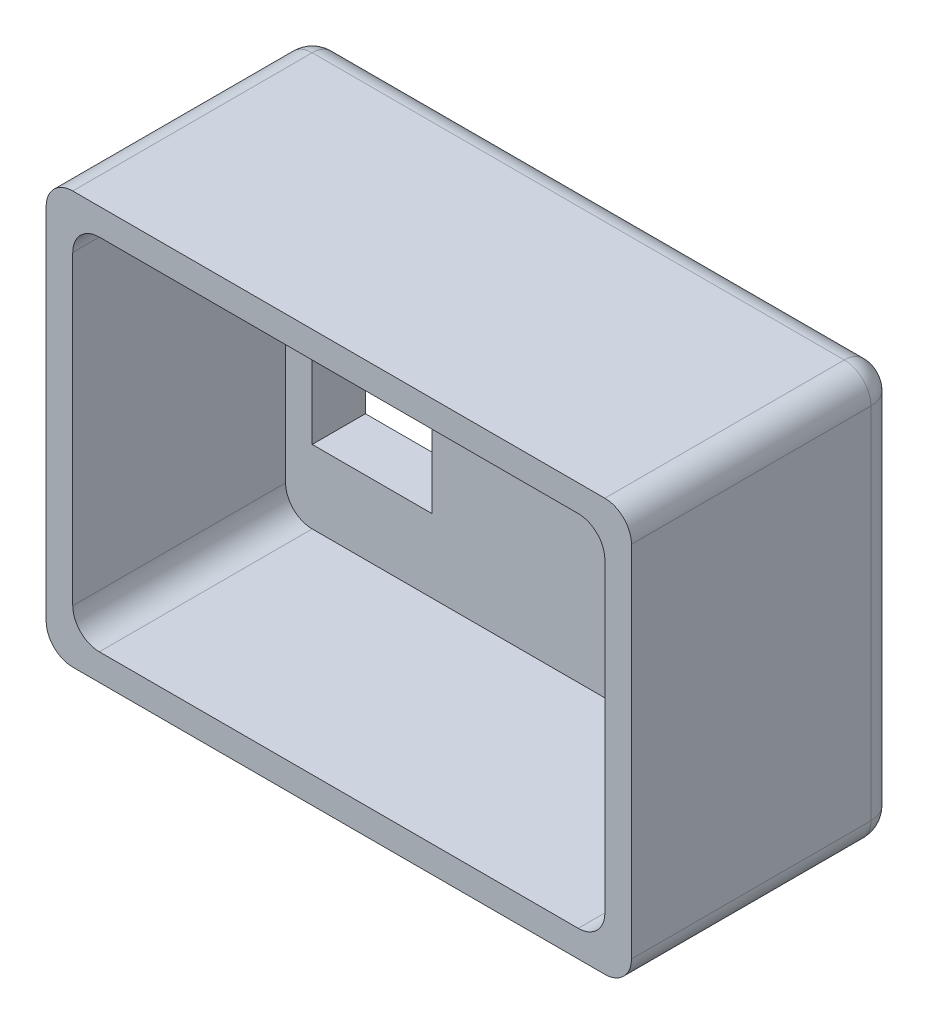
from build123d import *

# Parameters (mm, degrees)
ESQUISSE1_W             = 20
ESQUISSE1_H             = 13.5
BOSS_EXTRU_1_DEPTH      = 2
ESQUISSE1_2_W           = 22
ESQUISSE1_2_H           = 15.5
ESQUISSE1_2_W_2         = 20
ESQUISSE1_2_H_2         = 13.5
EXTRU_MINCE1_DEPTH      = 10
ESQUISSE2_W             = 4.5
ESQUISSE2_H             = 9
ENL_V_MAT_EXTRU_1_DEPTH = 10
CONG_1_R                = 1
CONG_2_R                = 1


with BuildPart() as part:
    # Esquisse1 → Boss.-Extru.1 (new body)
    with BuildSketch(Plane.XY):
        with Locations((10, 6.75)):
            Rectangle(ESQUISSE1_W, ESQUISSE1_H)
    extrude(amount=BOSS_EXTRU_1_DEPTH)

    # Esquisse1<2> → Extru.-Mince1 (add)
    with BuildSketch(Plane.XY):
        with Locations((10, 6.75)):
            Rectangle(ESQUISSE1_2_W, ESQUISSE1_2_H)
        with Locations((10, 6.75)):
            Rectangle(ESQUISSE1_2_W_2, ESQUISSE1_2_H_2, mode=Mode.SUBTRACT)
    extrude(amount=EXTRU_MINCE1_DEPTH)

    # Esquisse2 → Enlèv. mat.-Extru.1 (cut)
    with BuildSketch(Plane.XY.offset(2)):
        with Locations((3.25, 7.25)):
            Rectangle(ESQUISSE2_W, ESQUISSE2_H)
    extrude(amount=-ENL_V_MAT_EXTRU_1_DEPTH, mode=Mode.SUBTRACT)

    # Congé1
    cong_1_edges = [part.edges().sort_by_distance(p)[0] for p in [
        (0, 0, 6),
        (0, 13.5, 6),
        (20, 13.5, 6),
        (20, 0, 6),
        (-1, -1, 5),
        (-1, 14.5, 5),
        (21, -1, 5),
        (21, 14.5, 5),
    ]]
    fillet(cong_1_edges, radius=CONG_1_R)

    # Congé2
    cong_2_edges = [part.edges().sort_by_distance(p)[0] for p in [
        (-0.7071067811865479, -0.7071067811865458, 0),
        (-1, 6.75, 0),
        (-0.707106781, 14.207106781, 0),
        (10, 14.5, 0),
        (20.707106781, 14.207106781, 0),
        (21, 6.75, 0),
        (20.707106781, -0.707106781, 0),
        (10, -1, 0),
    ]]
    fillet(cong_2_edges, radius=CONG_2_R)


solid = part.part
